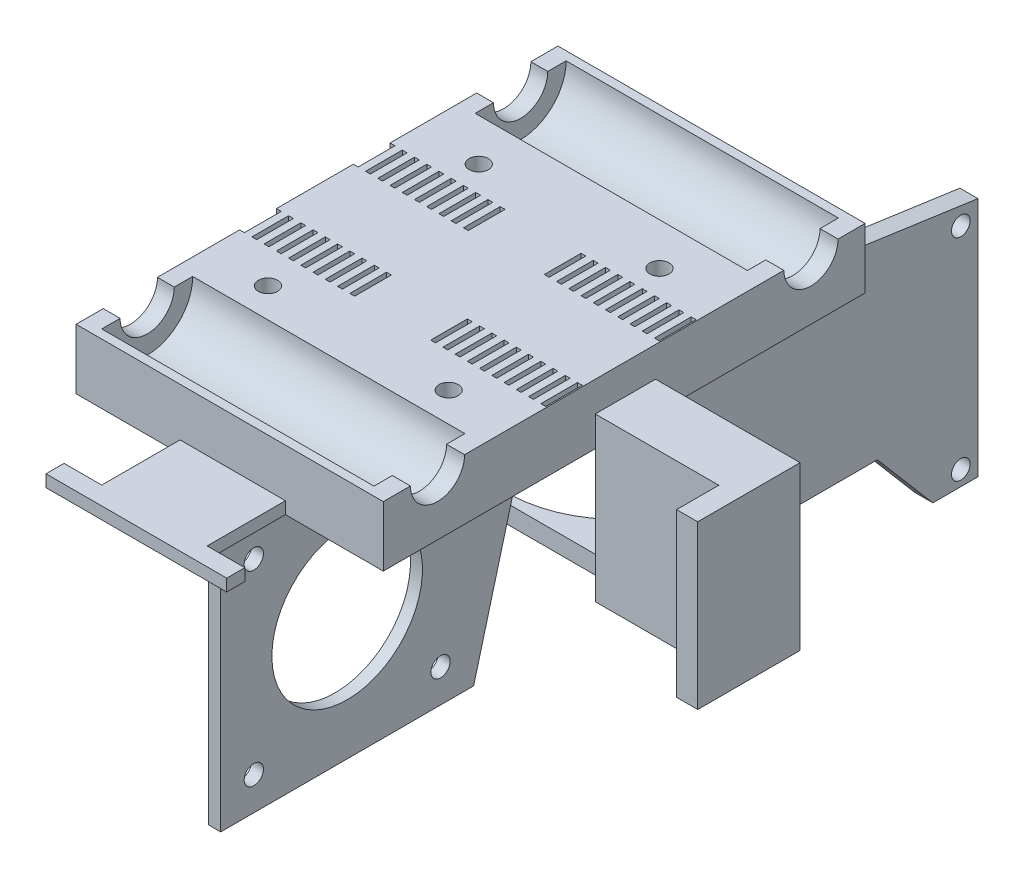
from build123d import *

# Parameters (mm, degrees)
SKETCH2_W               = 51
SKETCH2_H               = 80
BOSS_EXTRUDE1_DEPTH     = 10
SKETCH4_R               = 7.55
CUT_EXTRUDE1_DEPTH      = 45.2
SKETCH5_R               = 4.5
CUT_EXTRUDE2_DEPTH      = 96.399161422
SKETCH6_R               = 1.6
CUT_EXTRUDE3_DEPTH      = 45.1
SKETCH9_R               = 1.1
CUT_EXTRUDE4_DEPTH      = 1.5
CUT_EXTRUDE5_DEPTH      = 5
CUT_EXTRUDE5_DEPTH_BACK = 2.3
SKETCH12_W              = 0.8
SKETCH12_H              = 6.1
CUT_EXTRUDE6_DEPTH      = 0.8
BOSS_EXTRUDE4_DEPTH     = 2
SKETCH14_R              = 1.6
BOSS_EXTRUDE5_DEPTH     = 2
SKETCH15_W              = 20
SKETCH15_H              = 10
SKETCH15_R              = 1.55
BOSS_EXTRUDE6_DEPTH     = 10.9
SKETCH16_R              = 1.6
BOSS_EXTRUDE7_DEPTH     = 3
SKETCH17_W              = 8
SKETCH17_H              = 30
SKETCH17_H_2            = 3
BOSS_EXTRUDE8_DEPTH     = 2
SKETCH18_R              = 1.55
BOSS_EXTRUDE9_DEPTH     = 3
CUT_EXTRUDE9_DEPTH      = 6
BOSS_EXTRUDE10_DEPTH    = 27
SKETCH22_R              = 12.5
CUT_EXTRUDE10_DEPTH     = 10
CUT_EXTRUDE11_DEPTH     = 136.899824214


with BuildPart() as part:
    # Sketch2 → Boss-Extrude1 (new body)
    with BuildSketch(Plane(origin=(0, 0, 0), x_dir=(1, 0, 0), z_dir=(0, 1, 0))):
        with Locations((25.5, 40)):
            Rectangle(SKETCH2_W, SKETCH2_H)
    extrude(amount=BOSS_EXTRUDE1_DEPTH)

    # Sketch4 → Cut-Extrude1 (cut)
    with BuildSketch(Plane(origin=(48, 0, 0), x_dir=(0, 0, -1), z_dir=(1, 0, 0))):
        with Locations((9, 10)):
            Circle(SKETCH4_R)
        with Locations((71, 10)):
            Circle(SKETCH4_R)
    extrude(amount=-CUT_EXTRUDE1_DEPTH, mode=Mode.SUBTRACT)

    # Sketch5 → Cut-Extrude2 (cut, through all)
    with BuildSketch(Plane(origin=(51, 0, 0), x_dir=(0, 0, -1), z_dir=(1, 0, 0))):
        with Locations((9, 10)):
            Circle(SKETCH5_R)
        with Locations((71, 10)):
            Circle(SKETCH5_R)
    extrude(amount=-CUT_EXTRUDE2_DEPTH, mode=Mode.SUBTRACT)

    # Sketch6 → Cut-Extrude3 (cut)
    with BuildSketch(Plane(origin=(0, 10, 0), x_dir=(1, 0, 0), z_dir=(0, 1, 0))):
        with Locations(Location((10.4, 56.45, 0), (0, 0, 270))):
            Circle(SKETCH6_R)
        with Locations(Location((40.4, 56.45, 0), (0, 0, 270))):
            Circle(SKETCH6_R)
        with Locations(Location((10.4, 21.45, 0), (0, 0, 270))):
            Circle(SKETCH6_R)
        with Locations(Location((40.4, 21.45, 0), (0, 0, 270))):
            Circle(SKETCH6_R)
    extrude(amount=-CUT_EXTRUDE3_DEPTH, mode=Mode.SUBTRACT)

    # Sketch9 → Cut-Extrude4 (cut)
    with BuildSketch(Plane.XZ):
        with Locations(Location((4.9, -70.26, 0), (0, 0, 270))):
            Circle(SKETCH9_R)
        with Locations(Location((4.9, -76.96, 0), (0, 0, 270))):
            Circle(SKETCH9_R)
    extrude(amount=-CUT_EXTRUDE4_DEPTH, mode=Mode.SUBTRACT)

    # Sketch10 → Cut-Extrude5 (cut, two sides: drawn at the far end of the back side and taken through both)
    with BuildSketch(Plane.XZ.offset(-CUT_EXTRUDE5_DEPTH_BACK)):
        Polygon((13.633161507, -21.45), (12.016580754, -18.65), (8.783419246, -18.65), (7.166838493, -21.45), (8.783419246, -24.25), (12.016580754, -24.25), align=None)
        Polygon((43.633161507, -21.45), (42.016580754, -18.65), (38.783419246, -18.65), (37.166838493, -21.45), (38.783419246, -24.25), (42.016580754, -24.25), align=None)
        Polygon((13.633161507, -56.45), (12.016580754, -53.65), (8.783419246, -53.65), (7.166838493, -56.45), (8.783419246, -59.25), (12.016580754, -59.25), align=None)
        Polygon((43.633161507, -56.45), (42.016580754, -53.65), (38.783419246, -53.65), (37.166838493, -56.45), (38.783419246, -59.25), (42.016580754, -59.25), align=None)
    extrude(amount=CUT_EXTRUDE5_DEPTH + CUT_EXTRUDE5_DEPTH_BACK, mode=Mode.SUBTRACT)

    # Sketch12 → Cut-Extrude6 (cut)
    with BuildSketch(Plane(origin=(0, 10, 0), x_dir=(1, 0, 0), z_dir=(0, 1, 0))):
        with Locations((0.4, 49.07)):
            Rectangle(SKETCH12_W, SKETCH12_H)
        with Locations((0.4, 30.2)):
            Rectangle(SKETCH12_W, SKETCH12_H)
        with Locations((2.432, 30.2)):
            Rectangle(SKETCH12_W, SKETCH12_H)
        with Locations((2.432, 49.07)):
            Rectangle(SKETCH12_W, SKETCH12_H)
        with Locations((4.464, 30.2)):
            Rectangle(SKETCH12_W, SKETCH12_H)
        with Locations((4.464, 49.07)):
            Rectangle(SKETCH12_W, SKETCH12_H)
        with Locations((6.496, 30.2)):
            Rectangle(SKETCH12_W, SKETCH12_H)
        with Locations((6.496, 49.07)):
            Rectangle(SKETCH12_W, SKETCH12_H)
        with Locations((8.528, 30.2)):
            Rectangle(SKETCH12_W, SKETCH12_H)
        with Locations((8.528, 49.07)):
            Rectangle(SKETCH12_W, SKETCH12_H)
        with Locations((10.56, 30.2)):
            Rectangle(SKETCH12_W, SKETCH12_H)
        with Locations((10.56, 49.07)):
            Rectangle(SKETCH12_W, SKETCH12_H)
        with Locations((12.592, 30.2)):
            Rectangle(SKETCH12_W, SKETCH12_H)
        with Locations((12.592, 49.07)):
            Rectangle(SKETCH12_W, SKETCH12_H)
        with Locations((14.624, 30.2)):
            Rectangle(SKETCH12_W, SKETCH12_H)
        with Locations((14.624, 49.07)):
            Rectangle(SKETCH12_W, SKETCH12_H)
        with Locations((16.656, 30.2)):
            Rectangle(SKETCH12_W, SKETCH12_H)
        with Locations((16.656, 49.07)):
            Rectangle(SKETCH12_W, SKETCH12_H)
        with Locations((18.688, 30.2)):
            Rectangle(SKETCH12_W, SKETCH12_H)
        with Locations((18.688, 49.07)):
            Rectangle(SKETCH12_W, SKETCH12_H)
        with Locations((32.112, 30.2)):
            Rectangle(SKETCH12_W, SKETCH12_H)
        with Locations((34.144, 30.2)):
            Rectangle(SKETCH12_W, SKETCH12_H)
        with Locations((36.176, 30.2)):
            Rectangle(SKETCH12_W, SKETCH12_H)
        with Locations((38.208, 30.2)):
            Rectangle(SKETCH12_W, SKETCH12_H)
        with Locations((40.24, 30.2)):
            Rectangle(SKETCH12_W, SKETCH12_H)
        with Locations((42.272, 30.2)):
            Rectangle(SKETCH12_W, SKETCH12_H)
        with Locations((44.304, 30.2)):
            Rectangle(SKETCH12_W, SKETCH12_H)
        with Locations((46.336, 30.2)):
            Rectangle(SKETCH12_W, SKETCH12_H)
        with Locations((48.368, 30.2)):
            Rectangle(SKETCH12_W, SKETCH12_H)
        with Locations((50.4, 30.2)):
            Rectangle(SKETCH12_W, SKETCH12_H)
        with Locations((48.368, 49.07)):
            Rectangle(SKETCH12_W, SKETCH12_H)
        with Locations((40.24, 49.07)):
            Rectangle(SKETCH12_W, SKETCH12_H)
        with Locations((42.272, 49.07)):
            Rectangle(SKETCH12_W, SKETCH12_H)
        with Locations((32.112, 49.07)):
            Rectangle(SKETCH12_W, SKETCH12_H)
        with Locations((34.144, 49.07)):
            Rectangle(SKETCH12_W, SKETCH12_H)
        with Locations((36.176, 49.07)):
            Rectangle(SKETCH12_W, SKETCH12_H)
        with Locations((38.208, 49.07)):
            Rectangle(SKETCH12_W, SKETCH12_H)
        with Locations((44.304, 49.07)):
            Rectangle(SKETCH12_W, SKETCH12_H)
        with Locations((46.336, 49.07)):
            Rectangle(SKETCH12_W, SKETCH12_H)
        with Locations((50.4, 49.07)):
            Rectangle(SKETCH12_W, SKETCH12_H)
    extrude(amount=-CUT_EXTRUDE6_DEPTH, mode=Mode.SUBTRACT)

    # Sketch13 → Boss-Extrude4 (add)
    with BuildSketch(Plane.XZ):
        Polygon((17.25, 0), (17.25, 13), (11, 13), (11, 16), (41, 16), (41, 13), (34.75, 13), (34.75, 0), align=None)
    extrude(amount=-BOSS_EXTRUDE4_DEPTH)

    # Sketch14 → Boss-Extrude5 (add)
    with BuildSketch(Plane(origin=(31, 0, 0), x_dir=(0, 0, -1), z_dir=(1, 0, 0))):
        Polygon((46.789764467, 0), (35, -44), (-7, -44), (-7, -2), (-7, 0), align=None)
        with Locations((-1.5, -7.5)):
            Circle(SKETCH14_R, mode=Mode.SUBTRACT)
        with Locations((29.5, -7.5)):
            Circle(SKETCH14_R, mode=Mode.SUBTRACT)
        with Locations((29.5, -38.5)):
            Circle(SKETCH14_R, mode=Mode.SUBTRACT)
        with Locations((-1.5, -38.5)):
            Circle(SKETCH14_R, mode=Mode.SUBTRACT)
    extrude(amount=-BOSS_EXTRUDE5_DEPTH)

    # Sketch15 → Boss-Extrude6 (add)
    with BuildSketch(Plane.XZ):
        with Locations((19.955, -68.0275)):
            Rectangle(SKETCH15_W, SKETCH15_H)
        with Locations(Location((26.955, -67.1275, 0), (0, 0, 270))):
            Circle(SKETCH15_R, mode=Mode.SUBTRACT)
        with Locations(Location((12.955, -67.1275, 0), (0, 0, 270))):
            Circle(SKETCH15_R, mode=Mode.SUBTRACT)
    extrude(amount=BOSS_EXTRUDE6_DEPTH)



with BuildPart() as body_2:
    # Sketch16 → Boss-Extrude7 (new body)
    with BuildSketch(Plane(origin=(0, -33, 0), x_dir=(-1, 0, 0), z_dir=(0, -1, 0))):
        with BuildLine():
            Line((-40, 50.0275), (-40, 90.0275))
            Line((-40, 90.0275), (-20, 90.0275))
            Line((-20, 90.0275), (-20, 88.5275))
            ThreePointArc((-20, 88.5275), (-33.081475452, 56.946024549), (-1.5, 70.0275))
            Line((-1.5, 70.0275), (0, 70.0275))
            Line((0, 70.0275), (0, 50.0275))
            Line((0, 50.0275), (-40, 50.0275))
        make_face()
        with Locations(Location((-36, 86.0275, 0), (0, 0, 90))):
            Circle(SKETCH16_R, mode=Mode.SUBTRACT)
        with Locations(Location((-4, 54.0275, 0), (0, 0, 90))):
            Circle(SKETCH16_R, mode=Mode.SUBTRACT)
        with Locations(Location((-36, 54.0275, 0), (0, 0, 90))):
            Circle(SKETCH16_R, mode=Mode.SUBTRACT)
    extrude(amount=-BOSS_EXTRUDE7_DEPTH)


with BuildPart() as part_1:
    add(part.part)

    add(body_2.part)  # Boss-Extrude8 merges body 2
    # Sketch17 → Boss-Extrude8 (add)
    with BuildSketch(Plane.XY.offset(-50.0275)):
        with Locations((4, -15)):
            Rectangle(SKETCH17_W, SKETCH17_H)
        with Locations((4, -31.5)):
            Rectangle(SKETCH17_W, SKETCH17_H_2)
    extrude(amount=BOSS_EXTRUDE8_DEPTH)

    # Sketch18 → Boss-Extrude9 (add)
    with BuildSketch(Plane(origin=(40, 0, 0), x_dir=(0, 0, -1), z_dir=(1, 0, 0))):
        Polygon((50.0275, -33), (50.0275, 0), (80, 0), (106.734025603, -3.8), (106.734025603, -43.8), (99.234025603, -43.8), (90.0275, -33), align=None)
        with Locations((68.8775, -6.297)):
            Circle(SKETCH18_R, mode=Mode.SUBTRACT)
        with Locations((103.8775, -6.297)):
            Circle(SKETCH18_R, mode=Mode.SUBTRACT)
        with Locations((103.8775, -41.297)):
            Circle(SKETCH18_R, mode=Mode.SUBTRACT)
    extrude(amount=BOSS_EXTRUDE9_DEPTH)

    # Sketch20 → Cut-Extrude9 (cut)
    with BuildSketch(Plane.XZ):
        Polygon((42.016580754, -59.25), (43.633161507, -56.45), (42.016580754, -53.65), (38.783419246, -53.65), (37.166838493, -56.45), (38.783419246, -59.25), align=None)
    extrude(amount=CUT_EXTRUDE9_DEPTH, mode=Mode.SUBTRACT)

    # Sketch21 → Boss-Extrude10 (add)
    with BuildSketch(Plane(origin=(0, 5, 0), x_dir=(-1, 0, 0), z_dir=(0, -1, 0))):
        Polygon((-71.5, 35.2), (-51, 35.2), (-51, 45.2), (-75, 45.2), (-75, 28.2), (-71.5, 28.2), align=None)
    extrude(amount=BOSS_EXTRUDE10_DEPTH)

    # Sketch22 → Cut-Extrude10 (cut)
    with BuildSketch(Plane.ZY.offset(-29)):
        with Locations((-14, -23)):
            Circle(SKETCH22_R)
    extrude(amount=-CUT_EXTRUDE10_DEPTH, mode=Mode.SUBTRACT)

    # Sketch23 → Cut-Extrude11 (cut, through all)
    with BuildSketch(Plane(origin=(0, -5.9, 0), x_dir=(-1, 0, 0), z_dir=(0, -1, 0))):
        Polygon((-16.188161507, 67.1275), (-14.571580754, 64.3275), (-11.338419246, 64.3275), (-9.721838493, 67.1275), (-11.338419246, 69.9275), (-14.571580754, 69.9275), align=None)
        Polygon((-23.721838493, 67.1275), (-25.338419246, 69.9275), (-28.571580754, 69.9275), (-30.188161507, 67.1275), (-28.571580754, 64.3275), (-25.338419246, 64.3275), align=None)
    extrude(amount=-CUT_EXTRUDE11_DEPTH, mode=Mode.SUBTRACT)


solid = part_1.part
